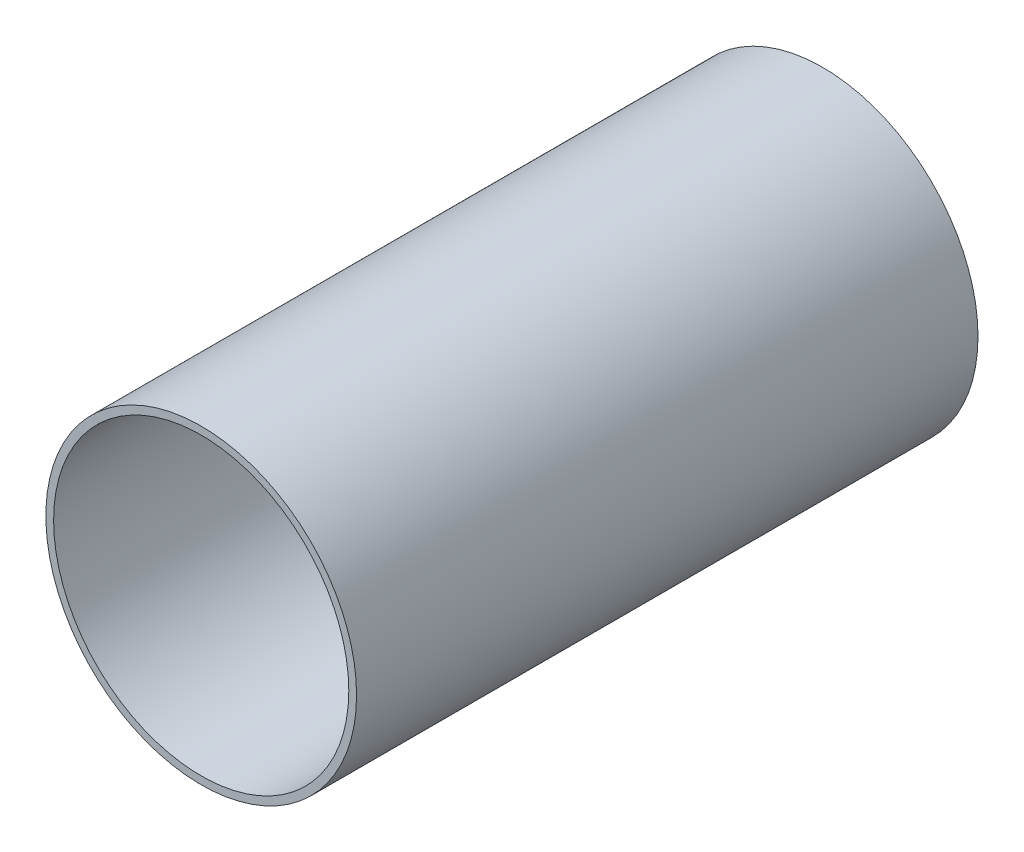
from build123d import *

# Parameters (mm, degrees)
SKETCH_1_R      = 10
SKETCH_1_R_2    = 9.5
EXTRUDE_1_DEPTH = 40


with BuildPart() as part:
    # 草图1 → 凸台-拉伸1 (new body)
    with BuildSketch(Plane.XY):
        Circle(SKETCH_1_R)
        Circle(SKETCH_1_R_2, mode=Mode.SUBTRACT)
    extrude(amount=EXTRUDE_1_DEPTH)


solid = part.part
